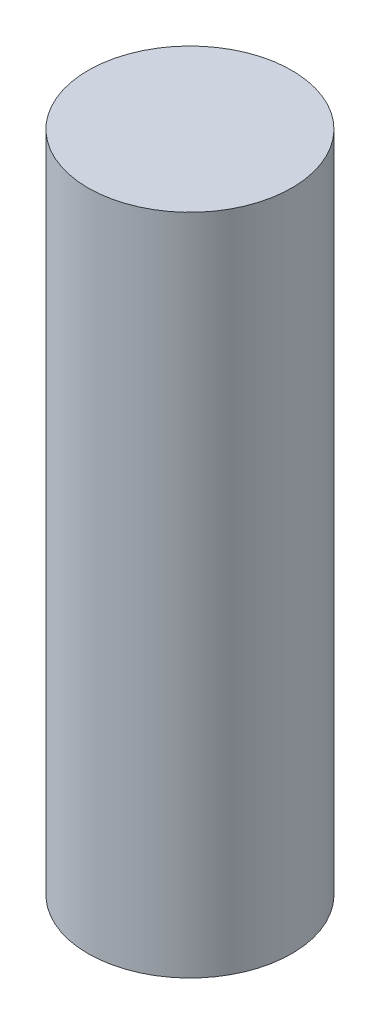
from build123d import *

# Parameters (mm, degrees)
SKETCH2_R           = 10.775
BOSS_EXTRUDE1_DEPTH = 70.15


with BuildPart() as part:
    # Sketch2 → Boss-Extrude1 (new body)
    with BuildSketch(Plane(origin=(0, 0, 0), x_dir=(1, 0, 0), z_dir=(0, 1, 0))):
        with Locations(Location((0, 0, 0), (0, 0, 270))):
            Circle(SKETCH2_R)
    extrude(amount=BOSS_EXTRUDE1_DEPTH)


solid = part.part
